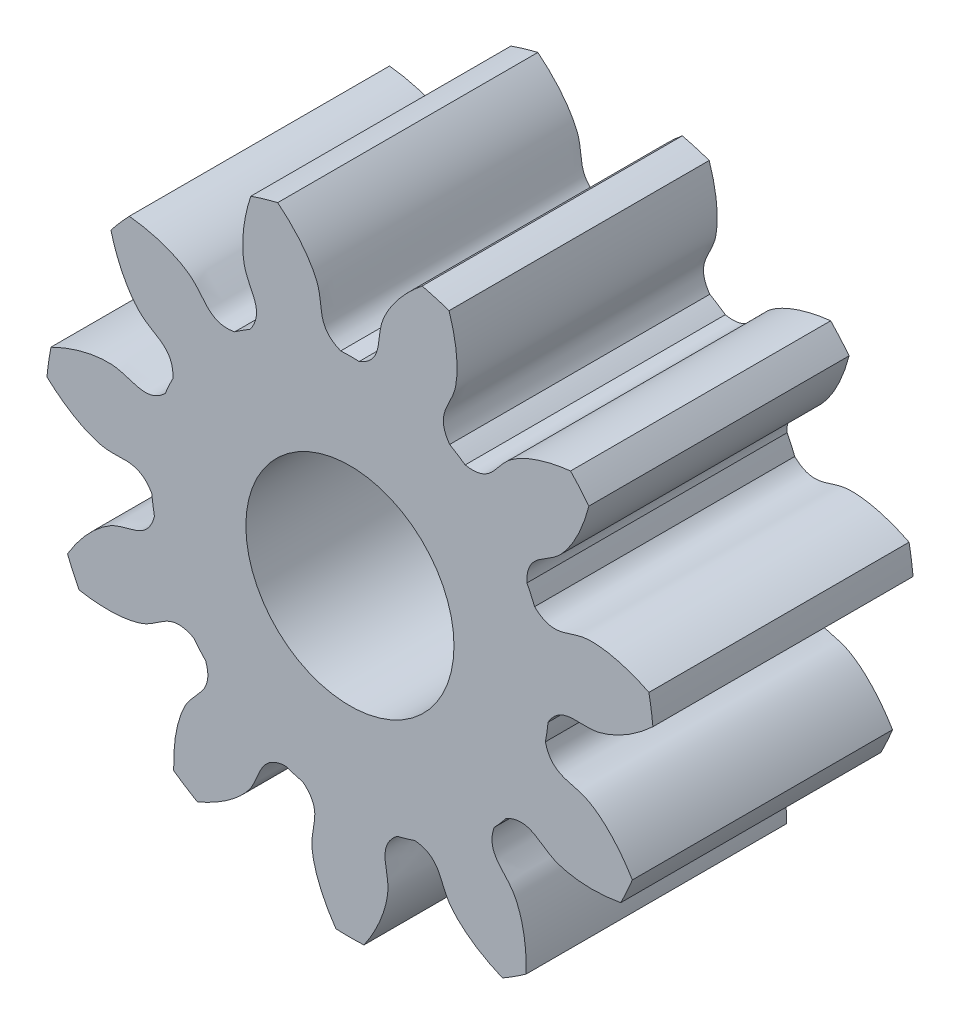
from build123d import *

# Parameters (mm, degrees)
SKETCH_1_R               = 2.925
EXTRUDE_1_DEPTH          = 2.5
CUT_EXTRUDE_1_DEPTH      = 5.833347701
PATTERN_CIRCULAR_1_COUNT = 11
SKETCH_4_R               = 1
CUT_EXTRUDE_2_DEPTH      = 5


with BuildPart() as part:
    # 草图1 → 凸台-拉伸1 (new body)
    with BuildSketch(Plane.XY):
        Circle(SKETCH_1_R)
    extrude(amount=EXTRUDE_1_DEPTH)

    # 草图2 → 切除-拉伸1 (cut, through all)
    with BuildSketch(Plane.XY):
        with BuildLine():
            ThreePointArc((0.08852987, 1.910449872), (0, 1.9125), (-0.08852987, 1.910449872))
            add(Edge.make_bspline(
                [(-0.08852987, 1.910449872), (-0.315659965, 2.000967152), (-0.258573558, 2.186101094), (-0.30708141, 2.343391426), (-0.309851997, 2.351784125), (-0.313099285, 2.36099721), (-0.316856321, 2.371014779), (-0.321156684, 2.381819732), (-0.326033159, 2.393394013), (-0.331518116, 2.405718553), (-0.337643355, 2.418773307), (-0.344440121, 2.432537255), (-0.351939064, 2.446988429), (-0.360170218, 2.462103917), (-0.369162977, 2.477859886), (-0.378946065, 2.494231597), (-0.389547516, 2.511193422), (-0.40099465, 2.52871886), (-0.413314046, 2.546780561), (-0.426531524, 2.565350339), (-0.440672115, 2.584399192), (-0.455760047, 2.60389733), (-0.471818719, 2.623814185), (-0.488870679, 2.644118439), (-0.506937607, 2.664778045), (-0.526040291, 2.685760249), (-0.54619861, 2.707031611), (-0.567431515, 2.728558032), (-0.589757009, 2.750304773), (-0.613192131, 2.772236485), (-0.637752937, 2.794317231), (-0.663454485, 2.816510508), (-0.690310819, 2.838779279), (-0.718334952, 2.861085995), (-0.747538853, 2.883392624), (-0.777933432, 2.905660673), (-0.809528526, 2.927851221), (-0.842332889, 2.949924944), (-0.876354178, 2.971842142), (-0.911598939, 2.99356277), (-0.948072603, 3.015046462), (-0.985779468, 3.036252566), (-1.024722698, 3.057140166), (-1.064904306, 3.077668119), (-1.106325154, 3.097795078), (-1.14898494, 3.117479524), (-1.192882194, 3.136679798), (-1.238014275, 3.155354129), (-1.284377358, 3.173460665), (-1.331966441, 3.190957502), (-1.380775332, 3.207802719), (-1.430796652, 3.223954403), (-1.482021826, 3.239370684), (-1.552511573, 3.259056282), (-1.606261107, 3.272328319), (-1.642556163, 3.280536787)],
                knots=[0, 0, 0, 0, 0.219011067, 0.222641587, 0.226699227, 0.231183987, 0.236095867, 0.241434867, 0.247200988, 0.253394228, 0.260014588, 0.267062068, 0.274536668, 0.282438388, 0.290767228, 0.299523189, 0.308706269, 0.318316469, 0.328353789, 0.338818229, 0.34970979, 0.36102847, 0.37277427, 0.38494719, 0.39754723, 0.410574391, 0.424028671, 0.437910071, 0.452218591, 0.466954232, 0.482116992, 0.497706872, 0.513723872, 0.530167993, 0.547039233, 0.564337593, 0.582063073, 0.600215674, 0.618795394, 0.637802234, 0.657236195, 0.677097275, 0.697385475, 0.718100796, 0.739243236, 0.760812796, 0.782809477, 0.805233277, 0.828084197, 0.851362238, 0.875067398, 0.899199678, 0.923759079, 0.948745599, 1, 1, 1, 1], degree=3))
            ThreePointArc((-1.642556163, 3.280536787), (0, 3.668775321), (1.642556163, 3.280536787))
            add(Edge.make_bspline(
                [(0.08852987, 1.910449872), (0.315659965, 2.000967152), (0.258573558, 2.186101094), (0.30708141, 2.343391426), (0.309851997, 2.351784125), (0.313099285, 2.36099721), (0.316856321, 2.371014779), (0.321156684, 2.381819732), (0.326033159, 2.393394013), (0.331518116, 2.405718553), (0.337643355, 2.418773307), (0.344440121, 2.432537255), (0.351939064, 2.446988429), (0.360170218, 2.462103917), (0.369162977, 2.477859886), (0.378946065, 2.494231597), (0.389547516, 2.511193422), (0.40099465, 2.52871886), (0.413314046, 2.546780561), (0.426531524, 2.565350339), (0.440672115, 2.584399192), (0.455760047, 2.60389733), (0.471818719, 2.623814185), (0.488870679, 2.644118439), (0.506937607, 2.664778045), (0.526040291, 2.685760249), (0.54619861, 2.707031611), (0.567431515, 2.728558032), (0.589757009, 2.750304773), (0.613192131, 2.772236485), (0.637752937, 2.794317231), (0.663454485, 2.816510508), (0.690310819, 2.838779279), (0.718334952, 2.861085995), (0.747538853, 2.883392624), (0.777933432, 2.905660673), (0.809528526, 2.927851221), (0.842332889, 2.949924944), (0.876354178, 2.971842142), (0.911598939, 2.99356277), (0.948072603, 3.015046462), (0.985779468, 3.036252566), (1.024722698, 3.057140166), (1.064904306, 3.077668119), (1.106325154, 3.097795078), (1.14898494, 3.117479524), (1.192882194, 3.136679798), (1.238014275, 3.155354129), (1.284377358, 3.173460665), (1.331966441, 3.190957502), (1.380775332, 3.207802719), (1.430796652, 3.223954403), (1.482021826, 3.239370684), (1.552511573, 3.259056282), (1.606261107, 3.272328319), (1.642556163, 3.280536787)],
                knots=[0, 0, 0, 0, 0.219011067, 0.222641587, 0.226699227, 0.231183987, 0.236095867, 0.241434867, 0.247200988, 0.253394228, 0.260014588, 0.267062068, 0.274536668, 0.282438388, 0.290767228, 0.299523189, 0.308706269, 0.318316469, 0.328353789, 0.338818229, 0.34970979, 0.36102847, 0.37277427, 0.38494719, 0.39754723, 0.410574391, 0.424028671, 0.437910071, 0.452218591, 0.466954232, 0.482116992, 0.497706872, 0.513723872, 0.530167993, 0.547039233, 0.564337593, 0.582063073, 0.600215674, 0.618795394, 0.637802234, 0.657236195, 0.677097275, 0.697385475, 0.718100796, 0.739243236, 0.760812796, 0.782809477, 0.805233277, 0.828084197, 0.851362238, 0.875067398, 0.899199678, 0.923759079, 0.948745599, 1, 1, 1, 1], degree=3))
        make_face()
    cut_extrude_1 = extrude(amount=CUT_EXTRUDE_1_DEPTH, mode=Mode.SUBTRACT)

    # 阵列(圆周)1: 切除-拉伸1 ×11 about axis
    pattern_circular_1_axis = Axis((0, 0, 2.5), (0, 0, -1))
    for i in range(1, PATTERN_CIRCULAR_1_COUNT):
        add(cut_extrude_1.rotate(pattern_circular_1_axis, i * 360 / PATTERN_CIRCULAR_1_COUNT), mode=Mode.SUBTRACT)

    # 草图4 → 切除-拉伸2 (cut, symmetric)
    with BuildSketch(Plane.XY.offset(2.5)):
        Circle(SKETCH_4_R)
    extrude(amount=CUT_EXTRUDE_2_DEPTH, both=True, mode=Mode.SUBTRACT)


solid = part.part
